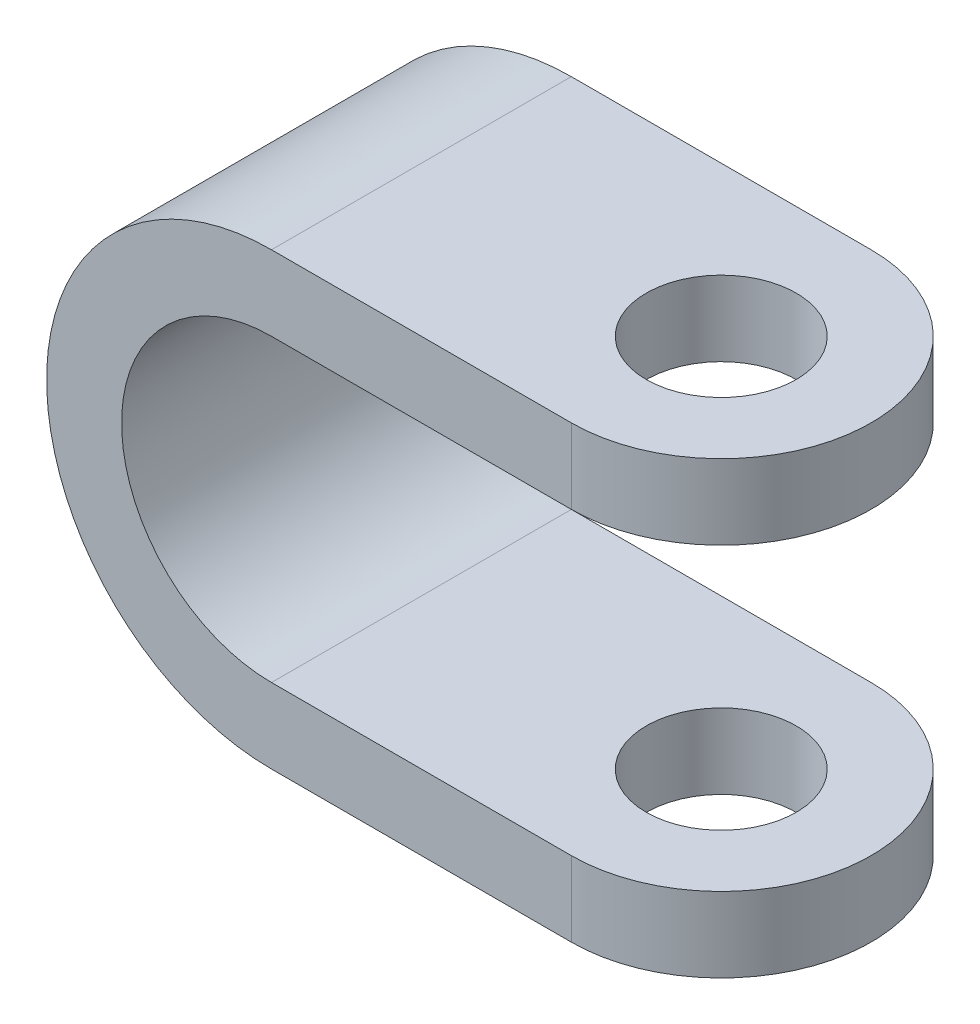
from build123d import *

# Parameters (mm, degrees)
EXTRUDE_THIN1_DEPTH = 90
SKETCH4_R           = 10
BOSS_EXTRUDE1_DEPTH = 90


with BuildPart() as part:
    # Sketch3 → Extrude-Thin1 (new body)
    with BuildSketch(Plane.XY):
        with BuildLine():
            Line((0, -15), (-60, -15))
            ThreePointArc((-60, -15), (-80, -35), (-60, -55))
            Line((-60, -55), (0, -55))
            Line((0, -55), (0, -65))
            Line((0, -65), (-60, -65))
            ThreePointArc((-60, -65), (-90, -35), (-60, -5))
            Line((-60, -5), (0, -5))
            Line((0, -5), (0, -15))
        make_face()
    extrude(amount=EXTRUDE_THIN1_DEPTH)


with BuildPart() as body_2:
    # Sketch4 → Boss-Extrude1 (new body)
    with BuildSketch(Plane(origin=(0, 0, 0), x_dir=(1, 0, 0), z_dir=(0, 1, 0))):
        with BuildLine():
            Line((-90, -25), (-90, -65))
            Line((-90, -65), (-20, -65))
            ThreePointArc((-20, -65), (0, -45), (-20, -25))
            Line((-20, -25), (-90, -25))
        make_face()
        with Locations((-20, -45)):
            Circle(SKETCH4_R, mode=Mode.SUBTRACT)
    extrude(amount=-BOSS_EXTRUDE1_DEPTH)


with BuildPart() as part_1:
    add(part.part)

    # Combine2: intersect body 2
    add(body_2.part, mode=Mode.INTERSECT)


solid = part_1.part
